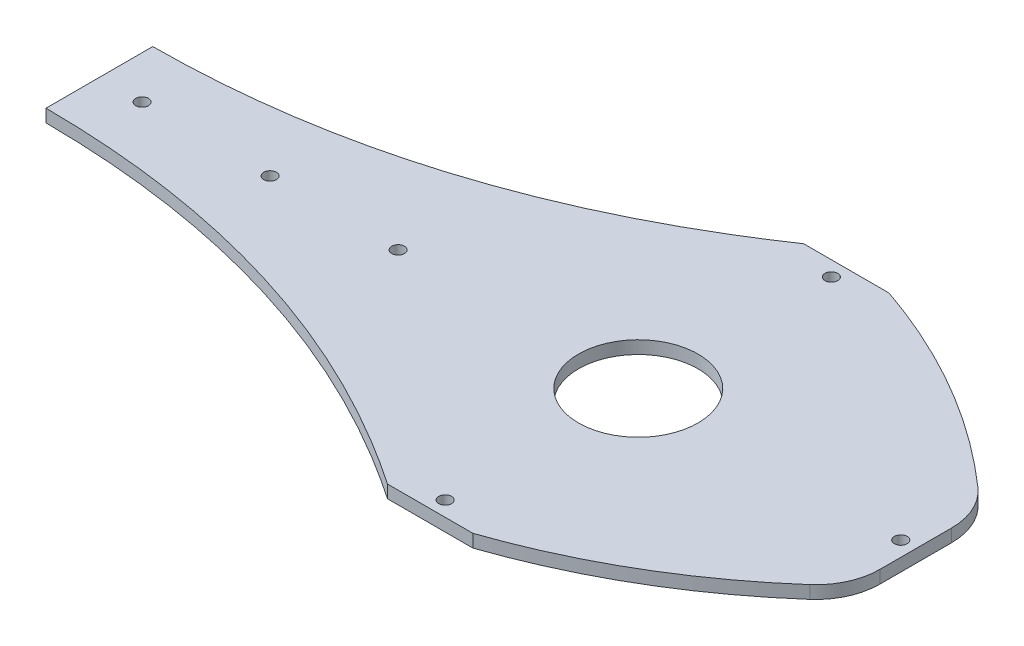
from build123d import *
from build123d.topology import SkipClean

# Parameters (mm, degrees)
BOSS_EXTRUDE1_DEPTH  = 1.5
SKETCH2_R            = 1.5
CUT_EXTRUDE1_DEPTH   = 82.305365895
FILLET1_R            = 15
FILLET1_OF_MIRROR2_R = 15
BOSS_EXTRUDE2_DEPTH  = 1.5
SKETCH4_R            = 14
CUT_EXTRUDE2_DEPTH   = 136.368478737


with BuildPart() as part:
    # Sketch1 → Boss-Extrude1 (new, symmetric)
    with BuildSketch(Plane(origin=(0, 0, 0), x_dir=(1, 0, 0), z_dir=(0, 1, 0))):
        with BuildLine():
            Line((0, 48.75), (0, 0))
            Line((0, 0), (65, 0))
            Line((65, 0), (65, 15))
            add(Edge.make_bspline(
                [(65, 15), (40.796135722, 38.189445994), (10, 48.75)],
                knots=[0, 0, 0, 1, 1, 1], degree=2))
            Line((10, 48.75), (0, 48.75))
        make_face()
    boss_extrude1 = extrude(amount=BOSS_EXTRUDE1_DEPTH, both=True)

    # Sketch2 → Cut-Extrude1 (cut, through all)
    with BuildSketch(Plane(origin=(0, 1.5, 0), x_dir=(1, 0, 0), z_dir=(0, 1, 0))):
        with Locations((0, 45.25)):
            Circle(SKETCH2_R)
        with Locations((61.5, 0)):
            Circle(SKETCH2_R)
    cut_extrude1 = extrude(amount=-CUT_EXTRUDE1_DEPTH, mode=Mode.SUBTRACT)

    # Fillet1
    fillet1_edges = [part.edges().sort_by_distance(p)[0] for p in [
        (65, 0.75, -15),
    ]]
    fillet(fillet1_edges, radius=FILLET1_R)

    # Mirror2: Boss-Extrude1, Cut-Extrude1 across plane
    with SkipClean():  # the faces are left unmerged after this step: merging them gives an invalid solid
        add(boss_extrude1.mirror(Plane.XY))
        add(cut_extrude1.mirror(Plane.XY), mode=Mode.SUBTRACT)

    # Fillet1 of Mirror2
    fillet1_of_mirror2_edges = [part.edges().sort_by_distance(p)[0] for p in [
        (65, 0.75, 15),
    ]]
    fillet(fillet1_of_mirror2_edges, radius=FILLET1_OF_MIRROR2_R)

    # Sketch3 → Boss-Extrude2 (add, symmetric)
    with BuildSketch(Plane(origin=(0, 0, 0), x_dir=(1, 0, 0), z_dir=(0, 1, 0))):
        with BuildLine():
            Line((0, 0), (0, 43.75))
            ThreePointArc((0, 43.75), (-1.5, 45.25), (0, 46.75))
            Line((0, 46.75), (0, 48.75))
            Line((0, 48.75), (-10, 48.75))
            add(Edge.make_bspline(
                [(-10, 48.75), (-62.853704869, 12.777917331), (-126.25, 12.5)],
                knots=[0.450666758, 0.450666758, 0.450666758, 1.450666758, 1.450666758, 1.450666758], degree=2))
            Line((-126.25, 12.5), (-126.25, 0))
            Line((-126.25, 0), (-117.75, 0))
            ThreePointArc((-117.75, 0), (-116.25, 1.5), (-114.75, 0))
            Line((-114.75, 0), (-87.75, 0))
            ThreePointArc((-87.75, 0), (-86.25, 1.5), (-84.75, 0))
            Line((-84.75, 0), (-57.75, 0))
            ThreePointArc((-57.75, 0), (-56.25, 1.5), (-54.75, 0))
            Line((-54.75, 0), (0, 0))
        make_face()
    boss_extrude2 = extrude(amount=BOSS_EXTRUDE2_DEPTH, both=True)

    # Mirror3: Boss-Extrude2 across plane
    with SkipClean():  # the faces are left unmerged after this step: merging them gives an invalid solid
        add(boss_extrude2.mirror(Plane.XY))

    # Sketch4 → Cut-Extrude2 (cut, through all)
    with BuildSketch(Plane(origin=(0, 1.5, 0), x_dir=(1, 0, 0), z_dir=(0, 1, 0))):
        Circle(SKETCH4_R)
    extrude(amount=-CUT_EXTRUDE2_DEPTH, mode=Mode.SUBTRACT)


solid = part.part
